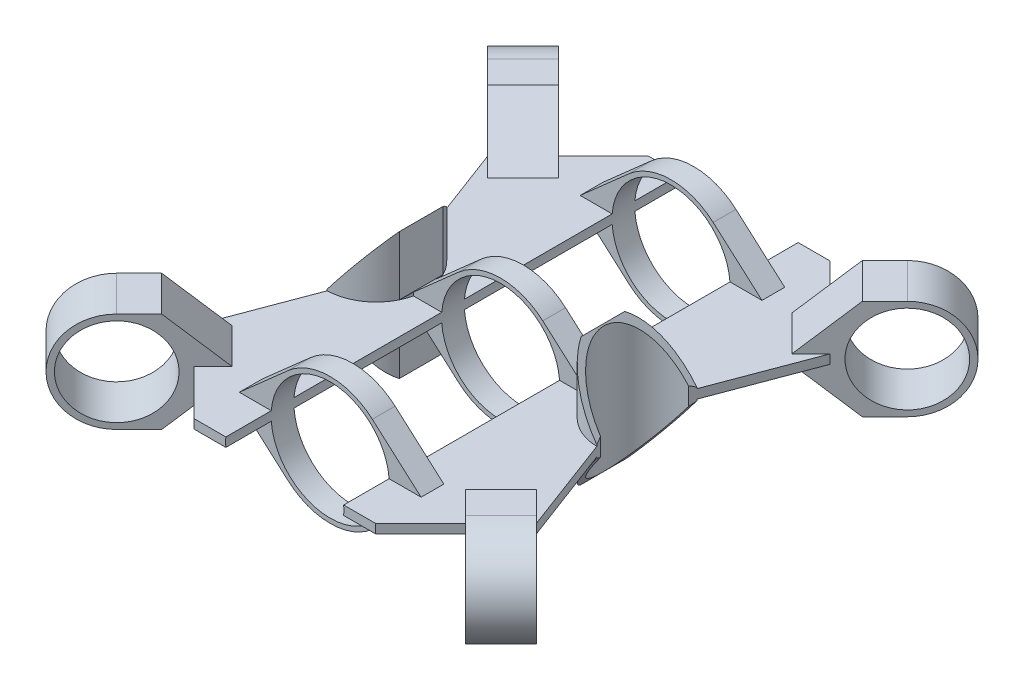
from build123d import *

# Parameters (mm, degrees)
Y_KSEKLIK_EKSTR_ZYON2_DEPTH      = 110
KES_EKSTR_ZYON1_START            = -50
KES_EKSTR_ZYON1_DEPTH            = 50
KES_EKSTR_ZYON2_DEPTH            = 50
IZIM6_R                          = 48.5
KES_EKSTR_ZYON3_DEPTH            = 500
KES_EKSTR_ZYON5_DEPTH            = 101
IZIM8_R                          = 48.5
KES_EKSTR_ZYON6_DEPTH            = 101
KES_EKSTR_ZYON7_DEPTH            = 101
IZIM10_R                         = 48.5
KES_EKSTR_ZYON8_DEPTH            = 101
KES_EKSTR_ZYON9_DEPTH            = 101
IZIM12_R                         = 48.5
KES_EKSTR_ZYON10_DEPTH           = 101
KES_EKSTR_ZYON11_DEPTH           = 101
Y_KSEKLIK_EKSTR_ZYON3_DEPTH      = 55
Y_KSEKLIK_EKSTR_ZYON4_DEPTH      = 55
Y_KSEKLIK_EKSTR_ZYON5_DEPTH      = 55
Y_KSEKLIK_EKSTR_ZYON6_DEPTH      = 55
Y_KSEKLIK_EKSTR_ZYON7_DEPTH      = 65
Y_KSEKLIK_EKSTR_ZYON7_DEPTH_BACK = 75
IZIM18_W                         = 200
IZIM18_H                         = 25
IZIM19_R                         = 65
KES_EKSTR_ZYON13_DEPTH           = 630
KES_EKSTR_ZYON16_DEPTH           = 547
KES_EKSTR_ZYON17_START           = -100
KES_EKSTR_ZYON17_DEPTH           = 274


with BuildPart() as part:
    # Çizim1 → Yükseklik-Ekstrüzyon2 (new body)
    with BuildSketch(Plane(origin=(0, 0, 0), x_dir=(1, 0, 0), z_dir=(0, 1, 0))):
        with BuildLine():
            Line((-234.350288425, 285.355339059), (-149.497474683, 200.502525317))
            Line((-149.497474683, 200.502525317), (-100, 250))
            Line((-100, 250), (100, 250))
            Line((100, 250), (149.497474683, 200.502525317))
            Line((149.497474683, 200.502525317), (234.350288425, 285.355339059))
            Line((234.350288425, 285.355339059), (273.241161391, 246.464466094))
            Line((273.241161391, 246.464466094), (188.388347648, 161.611652352))
            Line((188.388347648, 161.611652352), (145.760773721, 48.355837971))
            ThreePointArc((145.760773721, 48.355837971), (100.997474683, 0), (145.760773721, -48.355837971))
            Line((145.760773721, -48.355837971), (188.388347648, -161.611652352))
            Line((188.388347648, -161.611652352), (273.241161391, -246.464466094))
            Line((273.241161391, -246.464466094), (234.350288425, -285.355339059))
            Line((234.350288425, -285.355339059), (149.497474683, -200.502525317))
            Line((149.497474683, -200.502525317), (100, -250))
            Line((100, -250), (-100, -250))
            Line((-100, -250), (-149.497474683, -200.502525317))
            Line((-149.497474683, -200.502525317), (-234.350288425, -285.355339059))
            Line((-234.350288425, -285.355339059), (-273.241161391, -246.464466094))
            Line((-273.241161391, -246.464466094), (-188.388347648, -161.611652352))
            Line((-188.388347648, -161.611652352), (-145.760773721, -48.355837971))
            ThreePointArc((-145.760773721, -48.355837971), (-100.997474683, 0), (-145.760773721, 48.355837971))
            Line((-145.760773721, 48.355837971), (-188.388347648, 161.611652352))
            Line((-188.388347648, 161.611652352), (-273.241161391, 246.464466094))
            Line((-273.241161391, 246.464466094), (-234.350288425, 285.355339059))
        make_face()
    extrude(amount=Y_KSEKLIK_EKSTR_ZYON2_DEPTH)

    # Çizim3 → Kes-Ekstrüzyon1 (cut)
    with BuildSketch(Plane(origin=(0, 110, 0), x_dir=(1, 0, 0), z_dir=(0, 1, 0)).offset(KES_EKSTR_ZYON1_START)):
        with BuildLine():
            Line((-145.760773721, 48.355837971), (-188.388347648, 161.611652352))
            Line((-188.388347648, 161.611652352), (-100, 250))
            Line((-100, 250), (100, 250))
            Line((100, 250), (188.388347648, 161.611652352))
            Line((188.388347648, 161.611652352), (145.760773721, 48.355837971))
            ThreePointArc((145.760773721, 48.355837971), (100.997474683, 0), (145.760773721, -48.355837971))
            Line((145.760773721, -48.355837971), (188.388347648, -161.611652352))
            Line((188.388347648, -161.611652352), (100, -250))
            Line((100, -250), (-100, -250))
            Line((-100, -250), (-188.388347648, -161.611652352))
            Line((-188.388347648, -161.611652352), (-145.760773721, -48.355837971))
            ThreePointArc((-145.760773721, -48.355837971), (-100.997474683, 0), (-145.760773721, 48.355837971))
        make_face()
    extrude(amount=KES_EKSTR_ZYON1_DEPTH, mode=Mode.SUBTRACT)

    # Çizim5 → Kes-Ekstrüzyon2 (cut)
    with BuildSketch(Plane.XZ):
        with BuildLine():
            Line((-145.760773721, 48.355837971), (-188.388347648, 161.611652352))
            Line((-188.388347648, 161.611652352), (-100, 250))
            Line((-100, 250), (100, 250))
            Line((100, 250), (188.388347648, 161.611652352))
            Line((188.388347648, 161.611652352), (145.760773721, 48.355837971))
            ThreePointArc((145.760773721, 48.355837971), (100.997474683, 0), (145.760773721, -48.355837971))
            Line((145.760773721, -48.355837971), (188.388347648, -161.611652352))
            Line((188.388347648, -161.611652352), (100, -250))
            Line((100, -250), (-100, -250))
            Line((-100, -250), (-188.388347648, -161.611652352))
            Line((-188.388347648, -161.611652352), (-145.760773721, -48.355837971))
            ThreePointArc((-145.760773721, -48.355837971), (-100.997474683, 0), (-145.760773721, 48.355837971))
        make_face()
    extrude(amount=-KES_EKSTR_ZYON2_DEPTH, mode=Mode.SUBTRACT)

    # Çizim6 → Kes-Ekstrüzyon3 (cut)
    with BuildSketch(Plane(origin=(-13.388347648, 0, 13.388347648), x_dir=(0.7071067811865476, 0, 0.7071067811865475), z_dir=(-0.7071067811865475, 0, 0.7071067811865476))):
        with Locations((-307.487373415, 55)):
            Circle(IZIM6_R)
    extrude(amount=-KES_EKSTR_ZYON3_DEPTH, mode=Mode.SUBTRACT)

    # Çizim7 → Kes-Ekstrüzyon5 (cut)
    with BuildSketch(Plane(origin=(-13.388347648, 0, 13.388347648), x_dir=(0.7071067811865476, 0, 0.7071067811865475), z_dir=(-0.7071067811865475, 0, 0.7071067811865476))):
        with BuildLine():
            ThreePointArc((-307.487373415, 0), (-362.487373415, 55), (-307.487373415, 110))
            Line((-307.487373415, 110), (-367.487373415, 110))
            Line((-367.487373415, 110), (-367.487373415, 0))
            Line((-367.487373415, 0), (-307.487373415, 0))
        make_face()
        with BuildLine():
            Line((-247.487373415, 110), (-307.487373415, 110))
            ThreePointArc((-307.487373415, 110), (-270.40638098, 95.620192023), (-252.715117665, 60))
            Line((-252.715117665, 60), (-247.487373415, 60))
            Line((-247.487373415, 60), (-247.487373415, 110))
        make_face()
        with BuildLine():
            ThreePointArc((-252.715117665, 50), (-270.40638098, 14.379807977), (-307.487373415, 0))
            Line((-307.487373415, 0), (-247.487373415, 0))
            Line((-247.487373415, 0), (-247.487373415, 50))
            Line((-247.487373415, 50), (-252.715117665, 50))
        make_face()
    extrude(amount=-KES_EKSTR_ZYON5_DEPTH, mode=Mode.SUBTRACT)

    # Çizim8 → Kes-Ekstrüzyon6 (cut)
    with BuildSketch(Plane(origin=(13.388347648, 0, 13.388347648), x_dir=(0.7071067811865476, 0, -0.7071067811865475), z_dir=(0.7071067811865475, 0, 0.7071067811865476))):
        with Locations((307.487373415, 55)):
            Circle(IZIM8_R)
    extrude(amount=-KES_EKSTR_ZYON6_DEPTH, mode=Mode.SUBTRACT)

    # Çizim9 → Kes-Ekstrüzyon7 (cut)
    with BuildSketch(Plane(origin=(13.388347648, 0, 13.388347648), x_dir=(0.7071067811865476, 0, -0.7071067811865475), z_dir=(0.7071067811865475, 0, 0.7071067811865476))):
        with BuildLine():
            ThreePointArc((307.487373415, 110), (362.487373415, 55), (307.487373415, 0))
            Line((307.487373415, 0), (367.487373415, 0))
            Line((367.487373415, 0), (367.487373415, 110))
            Line((367.487373415, 110), (307.487373415, 110))
        make_face()
        with BuildLine():
            Line((247.487373415, 0), (307.487373415, 0))
            ThreePointArc((307.487373415, 0), (270.40638098, 14.379807977), (252.715117665, 50))
            Line((252.715117665, 50), (247.487373415, 50))
            Line((247.487373415, 50), (247.487373415, 0))
        make_face()
        with BuildLine():
            Line((247.487373415, 60), (252.715117665, 60))
            ThreePointArc((252.715117665, 60), (270.40638098, 95.620192023), (307.487373415, 110))
            Line((307.487373415, 110), (247.487373415, 110))
            Line((247.487373415, 110), (247.487373415, 60))
        make_face()
    extrude(amount=-KES_EKSTR_ZYON7_DEPTH, mode=Mode.SUBTRACT)

    # Çizim10 → Kes-Ekstrüzyon8 (cut)
    with BuildSketch(Plane(origin=(25.502525317, 0, 25.502525317), x_dir=(0.707106781186548, 0, -0.7071067811865471), z_dir=(0.7071067811865471, 0, 0.707106781186548))):
        with Locations((-307.487373415, 55)):
            Circle(IZIM10_R)
    extrude(amount=-KES_EKSTR_ZYON8_DEPTH, mode=Mode.SUBTRACT)

    # Çizim11 → Kes-Ekstrüzyon9 (cut)
    with BuildSketch(Plane(origin=(25.502525317, 0, 25.502525317), x_dir=(0.707106781186548, 0, -0.7071067811865471), z_dir=(0.7071067811865471, 0, 0.707106781186548))):
        with BuildLine():
            ThreePointArc((-252.715117665, 50), (-270.40638098, 14.379807977), (-307.487373415, 0))
            Line((-307.487373415, 0), (-247.487373415, 0))
            Line((-247.487373415, 0), (-247.487373415, 50))
            Line((-247.487373415, 50), (-252.715117665, 50))
        make_face()
        with BuildLine():
            Line((-367.487373415, 0), (-307.487373415, 0))
            ThreePointArc((-307.487373415, 0), (-362.487373415, 55), (-307.487373415, 110))
            Line((-307.487373415, 110), (-367.487373415, 110))
            Line((-367.487373415, 110), (-367.487373415, 0))
        make_face()
        with BuildLine():
            Line((-247.487373415, 110), (-307.487373415, 110))
            ThreePointArc((-307.487373415, 110), (-270.40638098, 95.620192023), (-252.715117665, 60))
            Line((-252.715117665, 60), (-247.487373415, 60))
            Line((-247.487373415, 60), (-247.487373415, 110))
        make_face()
    extrude(amount=-KES_EKSTR_ZYON9_DEPTH, mode=Mode.SUBTRACT)

    # Çizim12 → Kes-Ekstrüzyon10 (cut)
    with BuildSketch(Plane(origin=(-25.502525317, 0, 25.502525317), x_dir=(0.707106781186548, 0, 0.7071067811865471), z_dir=(-0.7071067811865471, 0, 0.707106781186548))):
        with Locations((307.487373415, 55)):
            Circle(IZIM12_R)
    extrude(amount=-KES_EKSTR_ZYON10_DEPTH, mode=Mode.SUBTRACT)

    # Çizim13 → Kes-Ekstrüzyon11 (cut)
    with BuildSketch(Plane(origin=(-25.502525317, 0, 25.502525317), x_dir=(0.707106781186548, 0, 0.7071067811865471), z_dir=(-0.7071067811865471, 0, 0.707106781186548))):
        with BuildLine():
            ThreePointArc((307.487373415, 110), (362.487373415, 55), (307.487373415, 0))
            Line((307.487373415, 0), (367.487373415, 0))
            Line((367.487373415, 0), (367.487373415, 110))
            Line((367.487373415, 110), (307.487373415, 110))
        make_face()
        with BuildLine():
            Line((247.487373415, 0), (307.487373415, 0))
            ThreePointArc((307.487373415, 0), (270.40638098, 14.379807977), (252.715117665, 50))
            Line((252.715117665, 50), (247.487373415, 50))
            Line((247.487373415, 50), (247.487373415, 0))
        make_face()
        with BuildLine():
            Line((247.487373415, 60), (252.715117665, 60))
            ThreePointArc((252.715117665, 60), (270.40638098, 95.620192023), (307.487373415, 110))
            Line((307.487373415, 110), (247.487373415, 110))
            Line((247.487373415, 110), (247.487373415, 60))
        make_face()
    extrude(amount=-KES_EKSTR_ZYON11_DEPTH, mode=Mode.SUBTRACT)

    # Çizim14 → Yükseklik-Ekstrüzyon3 (add)
    with BuildSketch(Plane(origin=(-13.388347648, 0, 13.388347648), x_dir=(0.7071067811865476, 0, 0.7071067811865475), z_dir=(-0.7071067811865475, 0, 0.7071067811865476))):
        with BuildLine():
            Line((-217.715117665, 60), (-272.487373415, 110))
            Line((-272.487373415, 110), (-307.487373415, 110))
            ThreePointArc((-307.487373415, 110), (-270.40638098, 95.620192023), (-252.715117665, 60))
            Line((-252.715117665, 60), (-247.487373415, 60))
            Line((-247.487373415, 60), (-247.487373415, 50))
            Line((-247.487373415, 50), (-252.715117665, 50))
            ThreePointArc((-252.715117665, 50), (-270.40638098, 14.379807977), (-307.487373415, 0))
            Line((-307.487373415, 0), (-272.487373415, 0))
            Line((-272.487373415, 0), (-217.715117665, 50))
            Line((-217.715117665, 50), (-217.715117665, 60))
        make_face()
    extrude(amount=-Y_KSEKLIK_EKSTR_ZYON3_DEPTH)

    # Çizim15 → Yükseklik-Ekstrüzyon4 (add)
    with BuildSketch(Plane(origin=(13.388347648, 0, 13.388347648), x_dir=(0.7071067811865476, 0, -0.7071067811865475), z_dir=(0.7071067811865475, 0, 0.7071067811865476))):
        with BuildLine():
            Line((307.487373415, 110), (272.487373415, 110))
            Line((272.487373415, 110), (217.715117665, 60))
            Line((217.715117665, 60), (252.715117665, 60))
            ThreePointArc((252.715117665, 60), (270.40638098, 95.620192023), (307.487373415, 110))
        make_face()
        with BuildLine():
            Line((217.715117665, 50), (252.715117665, 50))
            ThreePointArc((252.715117665, 50), (270.40638098, 14.379807977), (307.487373415, 0))
            Line((307.487373415, 0), (272.487373415, 0))
            Line((272.487373415, 0), (217.715117665, 50))
        make_face()
    extrude(amount=-Y_KSEKLIK_EKSTR_ZYON4_DEPTH)

    # Çizim16 → Yükseklik-Ekstrüzyon5 (add)
    with BuildSketch(Plane(origin=(25.502525317, 0, 25.502525317), x_dir=(0.707106781186548, 0, -0.7071067811865471), z_dir=(0.7071067811865471, 0, 0.707106781186548))):
        with BuildLine():
            Line((-272.487373415, 110), (-307.487373415, 110))
            ThreePointArc((-307.487373415, 110), (-270.40638098, 95.620192023), (-252.715117665, 60))
            Line((-252.715117665, 60), (-217.715117665, 60))
            Line((-217.715117665, 60), (-272.487373415, 110))
        make_face()
        with BuildLine():
            ThreePointArc((-252.715117665, 50), (-270.40638098, 14.379807977), (-307.487373415, 0))
            Line((-307.487373415, 0), (-272.487373415, 0))
            Line((-272.487373415, 0), (-217.715117665, 50))
            Line((-217.715117665, 50), (-252.715117665, 50))
        make_face()
    extrude(amount=-Y_KSEKLIK_EKSTR_ZYON5_DEPTH)

    # Çizim17 → Yükseklik-Ekstrüzyon6 (add)
    with BuildSketch(Plane(origin=(-25.502525317, 0, 25.502525317), x_dir=(0.707106781186548, 0, 0.7071067811865471), z_dir=(-0.7071067811865471, 0, 0.707106781186548))):
        with BuildLine():
            Line((307.487373415, 110), (272.487373415, 110))
            Line((272.487373415, 110), (217.715117665, 60))
            Line((217.715117665, 60), (252.715117665, 60))
            ThreePointArc((252.715117665, 60), (270.40638098, 95.620192023), (307.487373415, 110))
        make_face()
        with BuildLine():
            Line((217.715117665, 50), (252.715117665, 50))
            ThreePointArc((252.715117665, 50), (270.40638098, 14.379807977), (307.487373415, 0))
            Line((307.487373415, 0), (272.487373415, 0))
            Line((272.487373415, 0), (217.715117665, 50))
        make_face()
    extrude(amount=-Y_KSEKLIK_EKSTR_ZYON6_DEPTH)

    # Çizim18 → Yükseklik-Ekstrüzyon7 (add, two sides: drawn at the far end of the back side and taken through both)
    with BuildSketch(Plane(origin=(0, 60, 0), x_dir=(1, 0, 0), z_dir=(0, 1, 0)).offset(-Y_KSEKLIK_EKSTR_ZYON7_DEPTH_BACK)):
        with Locations((0, 187.5)):
            Rectangle(IZIM18_W, IZIM18_H)
        with BuildLine():
            Line((50, -12.5), (-50, -12.5))
            Line((-50, -12.5), (-95.936761469, -12.5))
            ThreePointArc((-95.936761469, -12.5), (-114.826479037, -42.695691363), (-148.256251783, -54.98599245))
            Line((-148.256251783, -54.98599245), (-145.760773721, -48.355837971))
            ThreePointArc((-145.760773721, -48.355837971), (-100.997474683, 0), (-145.760773721, 48.355837971))
            Line((-145.760773721, 48.355837971), (-148.256251783, 54.98599245))
            ThreePointArc((-148.256251783, 54.98599245), (-114.826479037, 42.695691363), (-95.936761469, 12.5))
            Line((-95.936761469, 12.5), (-50, 12.5))
            Line((-50, 12.5), (50, 12.5))
            Line((50, 12.5), (95.936761469, 12.5))
            ThreePointArc((95.936761469, 12.5), (114.826479037, 42.695691363), (148.256251783, 54.98599245))
            Line((148.256251783, 54.98599245), (145.760773721, 48.355837971))
            ThreePointArc((145.760773721, 48.355837971), (100.997474683, 0), (145.760773721, -48.355837971))
            Line((145.760773721, -48.355837971), (148.256251783, -54.98599245))
            ThreePointArc((148.256251783, -54.98599245), (114.826479037, -42.695691363), (95.936761469, -12.5))
            Line((95.936761469, -12.5), (50, -12.5))
        make_face()
        with Locations((0, -187.5)):
            Rectangle(IZIM18_W, IZIM18_H)
    extrude(amount=Y_KSEKLIK_EKSTR_ZYON7_DEPTH + Y_KSEKLIK_EKSTR_ZYON7_DEPTH_BACK)

    # Çizim19 → Kes-Ekstrüzyon13 (cut)
    with BuildSketch(Plane.XY.offset(250)):
        with Locations((0, 55)):
            Circle(IZIM19_R)
    extrude(amount=-KES_EKSTR_ZYON13_DEPTH, mode=Mode.SUBTRACT)

    # Çizim20 → Kes-Ekstrüzyon16 (cut)
    with BuildSketch(Plane.XY.offset(200)):
        with BuildLine():
            Line((-100, 125), (-100, 60))
            Line((-100, 60), (-46.378435226, 107.431295483))
            ThreePointArc((-46.378435226, 107.431295483), (-24.797271183, 120.460639639), (0, 125))
            Line((0, 125), (-100, 125))
        make_face()
        with BuildLine():
            Line((-46.378435226, 2.568704517), (-100, 50))
            Line((-100, 50), (-100, -15))
            Line((-100, -15), (-1.85e-07, -15))
            ThreePointArc((-1.85e-07, -15), (-24.797271269, -10.460639606), (-46.378435226, 2.568704517))
        make_face()
        with BuildLine():
            Line((100, 125), (0, 125))
            ThreePointArc((0, 125), (24.797271183, 120.460639639), (46.378435226, 107.431295483))
            Line((46.378435226, 107.431295483), (100, 60))
            Line((100, 60), (100, 125))
        make_face()
        with BuildLine():
            ThreePointArc((46.378435226, 2.568704517), (24.797271096, -10.460639671), (-1.85e-07, -15))
            Line((-1.85e-07, -15), (100, -15))
            Line((100, -15), (100, 50))
            Line((100, 50), (46.378435226, 2.568704517))
        make_face()
    extrude(amount=-KES_EKSTR_ZYON16_DEPTH, mode=Mode.SUBTRACT)

    # Çizim22 → Kes-Ekstrüzyon17 (cut)
    with BuildSketch(Plane.XY.offset(250).offset(KES_EKSTR_ZYON17_START)):
        Polygon((-100, 125), (-149.497474683, 60), (-148.256251783, 125), align=None)
        Polygon((100, 125), (149.497474683, 60), (148.256251783, 125), align=None)
        Polygon((-149.497474683, 50), (-148.256251783, -15), (-100, -15), align=None)
        Polygon((149.497474683, 50), (100.997474683, -15), (148.256251783, -15), align=None)
    extrude(amount=-KES_EKSTR_ZYON17_DEPTH, mode=Mode.SUBTRACT)


solid = part.part
